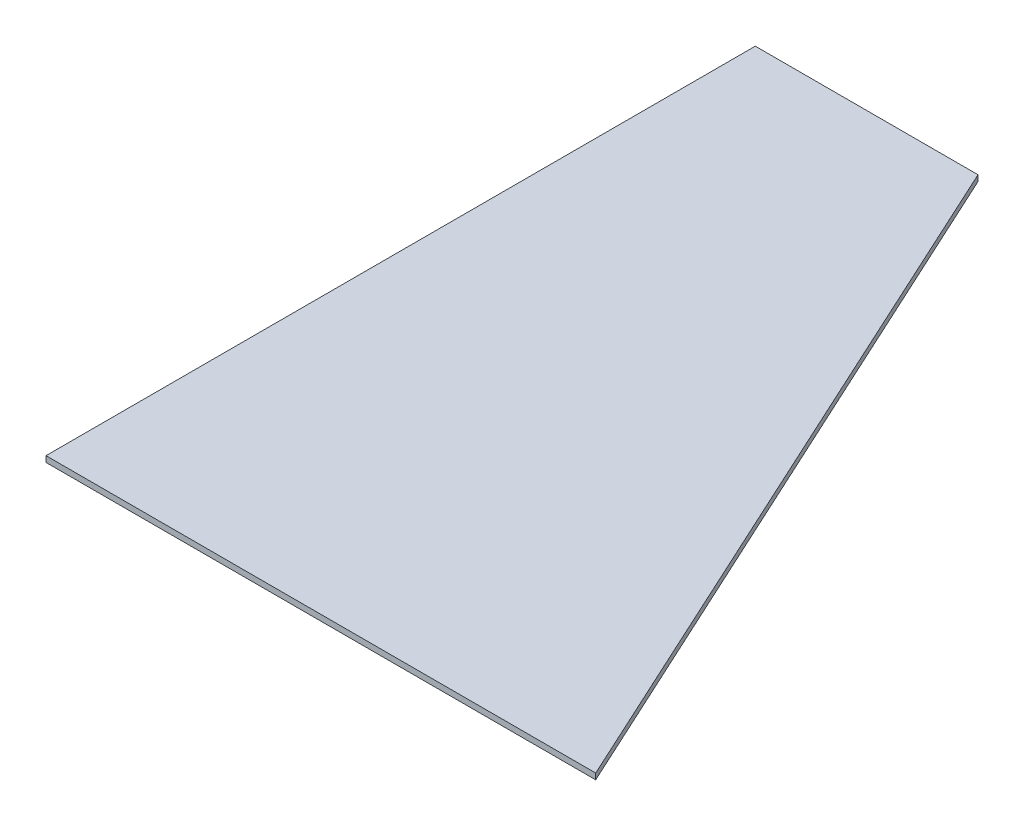
from build123d import *

# Parameters (mm, degrees)
BOSS_EXTRUDE1_DEPTH = 6.35


with BuildPart() as part:
    # Sketch1 → Boss-Extrude1 (new body)
    with BuildSketch(Plane(origin=(0, 0, 0), x_dir=(1, 0, 0), z_dir=(0, 1, 0))):
        Polygon((0, 0), (590.55, 0), (239.263188406, 762), (0, 762), align=None)
    extrude(amount=BOSS_EXTRUDE1_DEPTH)


solid = part.part
